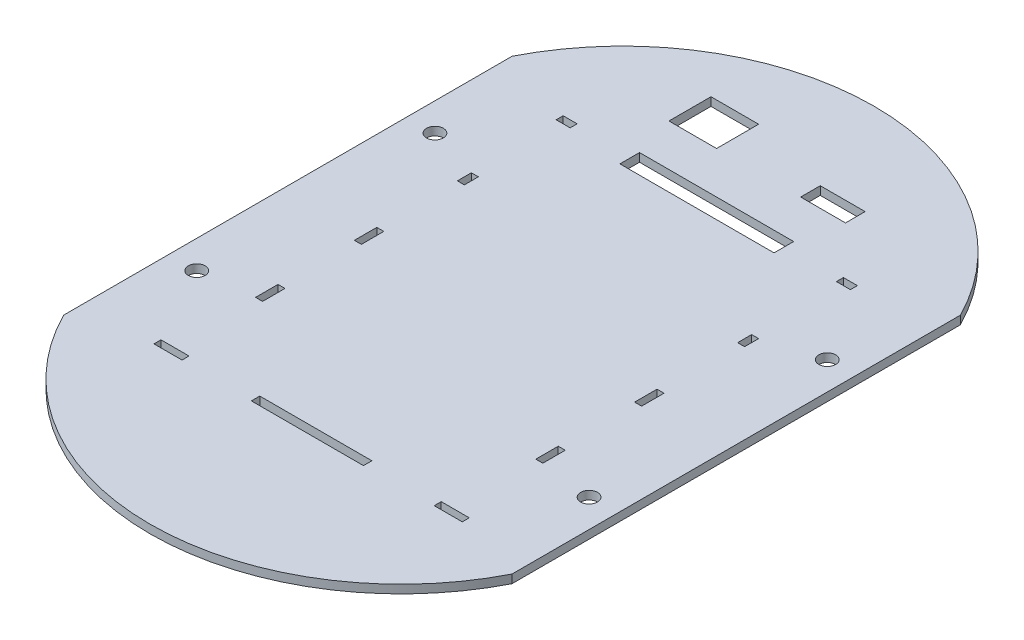
from build123d import *

# Parameters (mm, degrees)
BOSS_EXTRUDE1_DEPTH = 3
SKETCH5_R           = 3
CUT_EXTRUDE2_DEPTH  = 44
SKETCH8_W           = 55
SKETCH8_H           = 7
SKETCH8_W_2         = 2.5
SKETCH8_H_2         = 8
SKETCH8_W_3         = 40
SKETCH8_H_3         = 3
SKETCH8_W_4         = 5
SKETCH8_H_4         = 2.5
SKETCH8_H_5         = 5
SKETCH8_W_5         = 10
CUT_EXTRUDE5_DEPTH  = 31
SKETCH9_W           = 17
SKETCH9_H           = 15
SKETCH9_W_2         = 16
SKETCH9_H_2         = 7
CUT_EXTRUDE6_DEPTH  = 29


with BuildPart() as part:
    # Sketch1 → Boss-Extrude1 (new body)
    with BuildSketch(Plane(origin=(0, 0, 0), x_dir=(1, 0, 0), z_dir=(0, 1, 0))):
        with BuildLine():
            Line((0, 0), (0, 160))
            ThreePointArc((0, 160), (80, 209.178296965), (160, 160))
            Line((160, 160), (160, 0))
            ThreePointArc((160, 0), (80, -49.178296965), (0, 0))
        make_face()
    extrude(amount=BOSS_EXTRUDE1_DEPTH)

    # Sketch5 → Cut-Extrude2 (cut)
    with BuildSketch(Plane(origin=(0, 3, 0), x_dir=(1, 0, 0), z_dir=(0, 1, 0))):
        with Locations(Location((10, 37.5, 0), (0, 0, 270))):
            Circle(SKETCH5_R)
        with Locations(Location((150, 37.5, 0), (0, 0, 270))):
            Circle(SKETCH5_R)
        with Locations(Location((150, 122.5, 0), (0, 0, 270))):
            Circle(SKETCH5_R)
        with Locations(Location((10, 122.5, 0), (0, 0, 270))):
            Circle(SKETCH5_R)
    extrude(amount=-CUT_EXTRUDE2_DEPTH, mode=Mode.SUBTRACT)

    # Sketch8 → Cut-Extrude5 (cut)
    with BuildSketch(Plane(origin=(0, 3, 0), x_dir=(1, 0, 0), z_dir=(0, 1, 0))):
        with Locations((80, 149.5)):
            Rectangle(SKETCH8_W, SKETCH8_H)
        with Locations((30, 43.75)):
            Rectangle(SKETCH8_W_2, SKETCH8_H_2)
        with Locations((80, 8.5)):
            Rectangle(SKETCH8_W_3, SKETCH8_H_3)
        with Locations((30, 149.5)):
            Rectangle(SKETCH8_W_4, SKETCH8_H_4)
        with Locations((130, 149.5)):
            Rectangle(SKETCH8_W_4, SKETCH8_H_4)
        with Locations((130, 114.25)):
            Rectangle(SKETCH8_W_2, SKETCH8_H_5)
        with Locations((30, 114.25)):
            Rectangle(SKETCH8_W_2, SKETCH8_H_5)
        with Locations((30, 79)):
            Rectangle(SKETCH8_W_2, SKETCH8_H_2)
        with Locations((130, 79)):
            Rectangle(SKETCH8_W_2, SKETCH8_H_2)
        with Locations((30, 8.5)):
            Rectangle(SKETCH8_W_5, SKETCH8_H_4)
        with Locations((130, 8.5)):
            Rectangle(SKETCH8_W_5, SKETCH8_H_4)
        with Locations((130, 43.75)):
            Rectangle(SKETCH8_W_2, SKETCH8_H_2)
    extrude(amount=-CUT_EXTRUDE5_DEPTH, mode=Mode.SUBTRACT)

    # Sketch9 → Cut-Extrude6 (cut)
    with BuildSketch(Plane(origin=(0, 3, 0), x_dir=(1, 0, 0), z_dir=(0, 1, 0))):
        with Locations((56.5, 175.5)):
            Rectangle(SKETCH9_W, SKETCH9_H)
        with Locations((103, 171.5)):
            Rectangle(SKETCH9_W_2, SKETCH9_H_2)
    extrude(amount=-CUT_EXTRUDE6_DEPTH, mode=Mode.SUBTRACT)


solid = part.part
